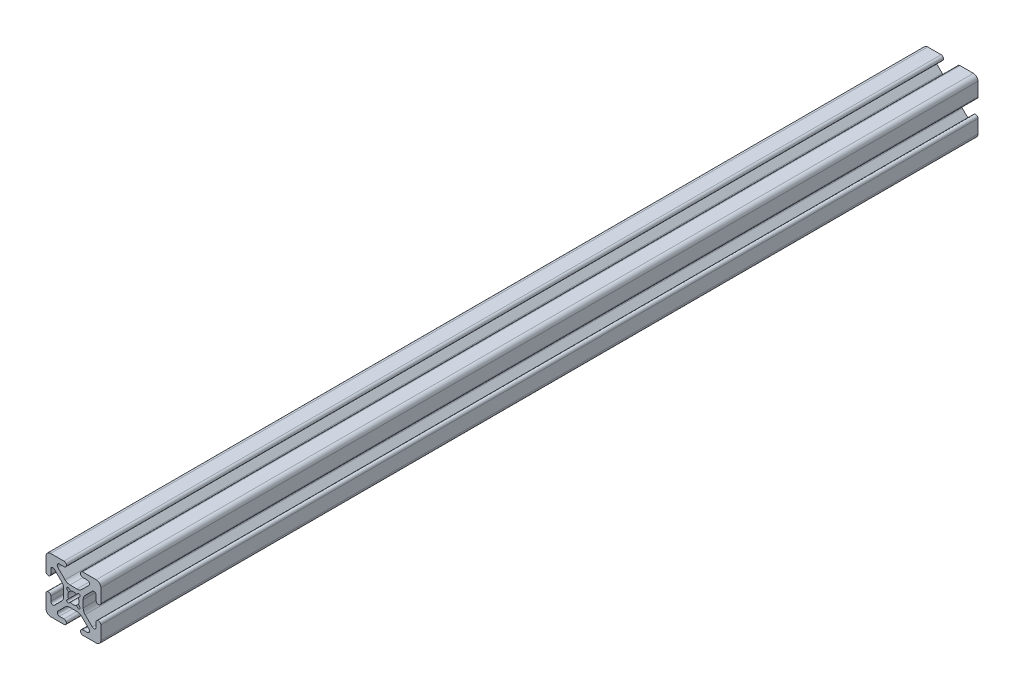
from build123d import *

# Parameters (mm, degrees)
EXTRUDE1_DEPTH = 406.4


with BuildPart() as part:
    # Sketch1 → Extrude1 (new body)
    with BuildSketch(Plane.XY):
        with BuildLine():
            Line((-3.88464389, 5.447103113), (-7.193320288, 8.75577951))
            ThreePointArc((-7.193320288, 8.75577951), (-7.413561403, 9.863006367), (-6.474899798, 10.4902))
            Line((-6.474899798, 10.4902), (-4.3561, 10.4902))
            ThreePointArc((-4.3561, 10.4902), (-3.2512, 11.5951), (-4.3561, 12.7))
            Line((-4.3561, 12.7), (-10.5918, 12.7))
            ThreePointArc((-10.5918, 12.7), (-12.082522516, 12.082522516), (-12.7, 10.5918))
            Line((-12.7, 10.5918), (-12.7, 4.3561))
            ThreePointArc((-12.7, 4.3561), (-11.5951, 3.2512), (-10.4902, 4.3561))
            Line((-10.4902, 4.3561), (-10.4902, 6.474899798))
            ThreePointArc((-10.4902, 6.474899798), (-9.863006367, 7.413561403), (-8.75577951, 7.193320288))
            Line((-8.75577951, 7.193320288), (-5.447103113, 3.88464389))
            ThreePointArc((-5.447103113, 3.88464389), (-4.758849627, 2.854599758), (-4.517167143, 1.63957986))
            Line((-4.517167143, 1.63957986), (-4.517167143, -1.63957986))
            ThreePointArc((-4.517167143, -1.63957986), (-4.758849627, -2.854599758), (-5.447103113, -3.88464389))
            Line((-5.447103113, -3.88464389), (-8.75577951, -7.193320288))
            ThreePointArc((-8.75577951, -7.193320288), (-9.863006367, -7.413561403), (-10.4902, -6.474899798))
            Line((-10.4902, -6.474899798), (-10.4902, -4.3561))
            ThreePointArc((-10.4902, -4.3561), (-11.5951, -3.2512), (-12.7, -4.3561))
            Line((-12.7, -4.3561), (-12.7, -10.5918))
            ThreePointArc((-12.7, -10.5918), (-12.082522516, -12.082522516), (-10.5918, -12.7))
            Line((-10.5918, -12.7), (-4.3561, -12.7))
            ThreePointArc((-4.3561, -12.7), (-3.2512, -11.5951), (-4.3561, -10.4902))
            Line((-4.3561, -10.4902), (-6.474899798, -10.4902))
            ThreePointArc((-6.474899798, -10.4902), (-7.413561403, -9.863006367), (-7.193320288, -8.75577951))
            Line((-7.193320288, -8.75577951), (-3.88464389, -5.447103113))
            ThreePointArc((-3.88464389, -5.447103113), (-2.854599758, -4.758849627), (-1.63957986, -4.517167143))
            Line((-1.63957986, -4.517167143), (1.63957986, -4.517167143))
            ThreePointArc((1.63957986, -4.517167143), (2.854599758, -4.758849627), (3.88464389, -5.447103113))
            Line((3.88464389, -5.447103113), (7.193320288, -8.75577951))
            ThreePointArc((7.193320288, -8.75577951), (7.413561403, -9.863006367), (6.474899798, -10.4902))
            Line((6.474899798, -10.4902), (4.3561, -10.4902))
            ThreePointArc((4.3561, -10.4902), (3.2512, -11.5951), (4.3561, -12.7))
            Line((4.3561, -12.7), (10.5918, -12.7))
            ThreePointArc((10.5918, -12.7), (12.082522516, -12.082522516), (12.7, -10.5918))
            Line((12.7, -10.5918), (12.7, -4.3561))
            ThreePointArc((12.7, -4.3561), (11.5951, -3.2512), (10.4902, -4.3561))
            Line((10.4902, -4.3561), (10.4902, -6.474899798))
            ThreePointArc((10.4902, -6.474899798), (9.863006367, -7.413561403), (8.75577951, -7.193320288))
            Line((8.75577951, -7.193320288), (5.447103113, -3.88464389))
            ThreePointArc((5.447103113, -3.88464389), (4.758849627, -2.854599758), (4.517167143, -1.63957986))
            Line((4.517167143, -1.63957986), (4.517167143, 1.63957986))
            ThreePointArc((4.517167143, 1.63957986), (4.758849627, 2.854599758), (5.447103113, 3.88464389))
            Line((5.447103113, 3.88464389), (8.75577951, 7.193320288))
            ThreePointArc((8.75577951, 7.193320288), (9.863006367, 7.413561403), (10.4902, 6.474899798))
            Line((10.4902, 6.474899798), (10.4902, 4.3561))
            ThreePointArc((10.4902, 4.3561), (11.5951, 3.2512), (12.7, 4.3561))
            Line((12.7, 4.3561), (12.7, 10.5918))
            ThreePointArc((12.7, 10.5918), (12.082522516, 12.082522516), (10.5918, 12.7))
            Line((10.5918, 12.7), (4.3561, 12.7))
            ThreePointArc((4.3561, 12.7), (3.2512, 11.5951), (4.3561, 10.4902))
            Line((4.3561, 10.4902), (6.474899798, 10.4902))
            ThreePointArc((6.474899798, 10.4902), (7.413561403, 9.863006367), (7.193320288, 8.75577951))
            Line((7.193320288, 8.75577951), (3.88464389, 5.447103113))
            ThreePointArc((3.88464389, 5.447103113), (2.854599758, 4.758849627), (1.63957986, 4.517167143))
            Line((1.63957986, 4.517167143), (-1.63957986, 4.517167143))
            ThreePointArc((-1.63957986, 4.517167143), (-2.854599758, 4.758849627), (-3.88464389, 5.447103113))
        make_face()
        with BuildLine():
            Line((-2.860474191, -1.969151357), (-2.231856263, -1.340533428))
            ThreePointArc((-2.231856263, -1.340533428), (-2.6035, 0), (-2.231856263, 1.340533428))
            Line((-2.231856263, 1.340533428), (-2.860474191, 1.969151357))
            ThreePointArc((-2.860474191, 1.969151357), (-2.918583239, 2.918583239), (-1.969151357, 2.860474191))
            Line((-1.969151357, 2.860474191), (-1.340533428, 2.231856263))
            ThreePointArc((-1.340533428, 2.231856263), (0, 2.6035), (1.340533428, 2.231856263))
            Line((1.340533428, 2.231856263), (1.969151357, 2.860474191))
            ThreePointArc((1.969151357, 2.860474191), (2.918583239, 2.918583239), (2.860474191, 1.969151357))
            Line((2.860474191, 1.969151357), (2.231856263, 1.340533428))
            ThreePointArc((2.231856263, 1.340533428), (2.6035, 0), (2.231856263, -1.340533428))
            Line((2.231856263, -1.340533428), (2.860474191, -1.969151357))
            ThreePointArc((2.860474191, -1.969151357), (2.918583239, -2.918583239), (1.969151357, -2.860474191))
            Line((1.969151357, -2.860474191), (1.340533428, -2.231856263))
            ThreePointArc((1.340533428, -2.231856263), (0, -2.6035), (-1.340533428, -2.231856263))
            Line((-1.340533428, -2.231856263), (-1.969151357, -2.860474191))
            ThreePointArc((-1.969151357, -2.860474191), (-2.918583239, -2.918583239), (-2.860474191, -1.969151357))
        make_face(mode=Mode.SUBTRACT)
    extrude(amount=-EXTRUDE1_DEPTH)


solid = part.part
